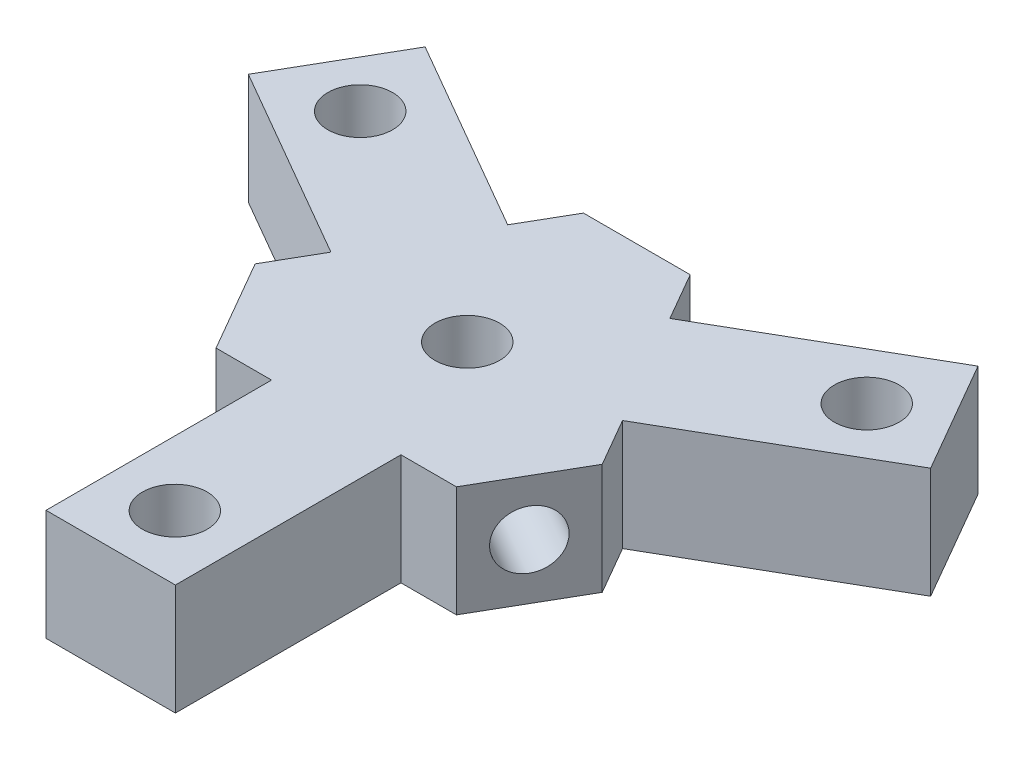
from build123d import *

# Parameters (mm, degrees)
SKETCH1_R           = 2.2225
BOSS_EXTRUDE2_DEPTH = 7.62
CUT_EXTRUDE1_DEPTH  = 6.35
CUT_EXTRUDE7_DEPTH  = 6.35
CUT_EXTRUDE8_DEPTH  = 6.35
SKETCH5_W           = 8.89
SKETCH5_H           = 15.494
SKETCH5_R           = 2.2225
BOSS_EXTRUDE3_DEPTH = 7.62


with BuildPart() as part:
    # Sketch1 → Boss-Extrude2 (new body)
    with BuildSketch(Plane(origin=(0, 0, 0), x_dir=(1, 0, 0), z_dir=(0, 1, 0))):
        Polygon((3.666174209, 11.65), (-3.666174209, 11.65), (-11.922283059, -2.65), (-8.256108849, -9), (8.256108849, -9), (11.922283059, -2.65), align=None)
        with Locations(Location((0, 0, 0), (0, 0, 90))):
            Circle(SKETCH1_R, mode=Mode.SUBTRACT)
    extrude(amount=BOSS_EXTRUDE2_DEPTH)

    # Sketch2 → Cut-Extrude1 (cut)
    with BuildSketch(Plane(origin=(-10.089195954, 0, 5.825), x_dir=(0.5000000000000006, 0, 0.8660254037844384), z_dir=(-0.8660254037844384, 0, 0.5000000000000006))):
        with BuildLine():
            ThreePointArc((0, 1.81), (1.414213562, 2.395786438), (2, 3.81))
            Line((2, 3.81), (0, 3.81))
            Line((0, 3.81), (0, 1.81))
        make_face()
        with BuildLine():
            Line((0, 3.81), (2, 3.81))
            ThreePointArc((2, 3.81), (1.414213562, 5.224213562), (0, 5.81))
            Line((0, 5.81), (0, 3.81))
        make_face()
        with BuildLine():
            Line((0, 1.81), (0, 3.81))
            Line((0, 3.81), (-2, 3.81))
            ThreePointArc((-2, 3.81), (-1.414213562, 2.395786438), (0, 1.81))
        make_face()
        with BuildLine():
            Line((-2, 3.81), (0, 3.81))
            Line((0, 3.81), (0, 5.81))
            ThreePointArc((0, 5.81), (-1.414213562, 5.224213562), (-2, 3.81))
        make_face()
    extrude(amount=-CUT_EXTRUDE1_DEPTH, mode=Mode.SUBTRACT)

    # Sketch3 → Cut-Extrude7 (cut)
    with BuildSketch(Plane(origin=(10.089195954, 0, 5.825), x_dir=(0.49999999999999983, 0, -0.8660254037844388), z_dir=(0.8660254037844387, 0, 0.4999999999999998))):
        with BuildLine():
            ThreePointArc((2, 3.81), (1.414213562, 5.224213562), (0, 5.81))
            Line((0, 5.81), (0, 3.81))
            Line((0, 3.81), (2, 3.81))
        make_face()
        with BuildLine():
            Line((0, 3.81), (0, 5.81))
            ThreePointArc((0, 5.81), (-1.414213562, 5.224213562), (-2, 3.81))
            Line((-2, 3.81), (0, 3.81))
        make_face()
        with BuildLine():
            Line((2, 3.81), (0, 3.81))
            Line((0, 3.81), (0, 1.81))
            ThreePointArc((0, 1.81), (1.414213562, 2.395786438), (2, 3.81))
        make_face()
        with BuildLine():
            Line((0, 1.81), (0, 3.81))
            Line((0, 3.81), (-2, 3.81))
            ThreePointArc((-2, 3.81), (-1.414213562, 2.395786438), (0, 1.81))
        make_face()
    extrude(amount=-CUT_EXTRUDE7_DEPTH, mode=Mode.SUBTRACT)

    # Sketch4 → Cut-Extrude8 (cut)
    with BuildSketch(Plane(origin=(0, 0, -11.65), x_dir=(-1, 0, 0), z_dir=(0, 0, -1))):
        with BuildLine():
            ThreePointArc((2, 3.81), (1.414213562, 5.224213562), (0, 5.81))
            Line((0, 5.81), (0, 3.81))
            Line((0, 3.81), (2, 3.81))
        make_face()
        with BuildLine():
            Line((0, 3.81), (0, 5.81))
            ThreePointArc((0, 5.81), (-1.414213562, 5.224213562), (-2, 3.81))
            Line((-2, 3.81), (0, 3.81))
        make_face()
        with BuildLine():
            Line((2, 3.81), (0, 3.81))
            Line((0, 3.81), (0, 1.81))
            ThreePointArc((0, 1.81), (1.414213562, 2.395786438), (2, 3.81))
        make_face()
        with BuildLine():
            Line((0, 1.81), (0, 3.81))
            Line((0, 3.81), (-2, 3.81))
            ThreePointArc((-2, 3.81), (-1.414213562, 2.395786438), (0, 1.81))
        make_face()
    extrude(amount=-CUT_EXTRUDE8_DEPTH, mode=Mode.SUBTRACT)

    # Sketch5 → Boss-Extrude3 (add)
    # profile 1 of 3: a face of its own
    with BuildSketch(Plane.XZ):
        with Locations((0, 16.747)):
            Rectangle(SKETCH5_W, SKETCH5_H)
        with Locations(Location((0, 20.09, 0), (0, 0, 270))):
            Circle(SKETCH5_R, mode=Mode.SUBTRACT)
    # profile 2 of 3: a face of its own
    with BuildSketch(Plane.XZ):
        Polygon((-5.571728634, -8.34948292), (-10.016728634, -0.65051708), (-23.43492624, -8.39751708), (-18.98992624, -16.09648292), align=None)
        with Locations(Location((-17.398450362, -10.045, 0), (0, 0, 270))):
            Circle(SKETCH5_R, mode=Mode.SUBTRACT)
    # profile 3 of 3: a face of its own
    with BuildSketch(Plane.XZ):
        Polygon((10.016728634, -0.65051708), (5.571728634, -8.34948292), (18.98992624, -16.09648292), (23.43492624, -8.39751708), align=None)
        with Locations(Location((17.398450362, -10.045, 0), (0, 0, 270))):
            Circle(SKETCH5_R, mode=Mode.SUBTRACT)
    extrude(amount=-BOSS_EXTRUDE3_DEPTH)


solid = part.part
